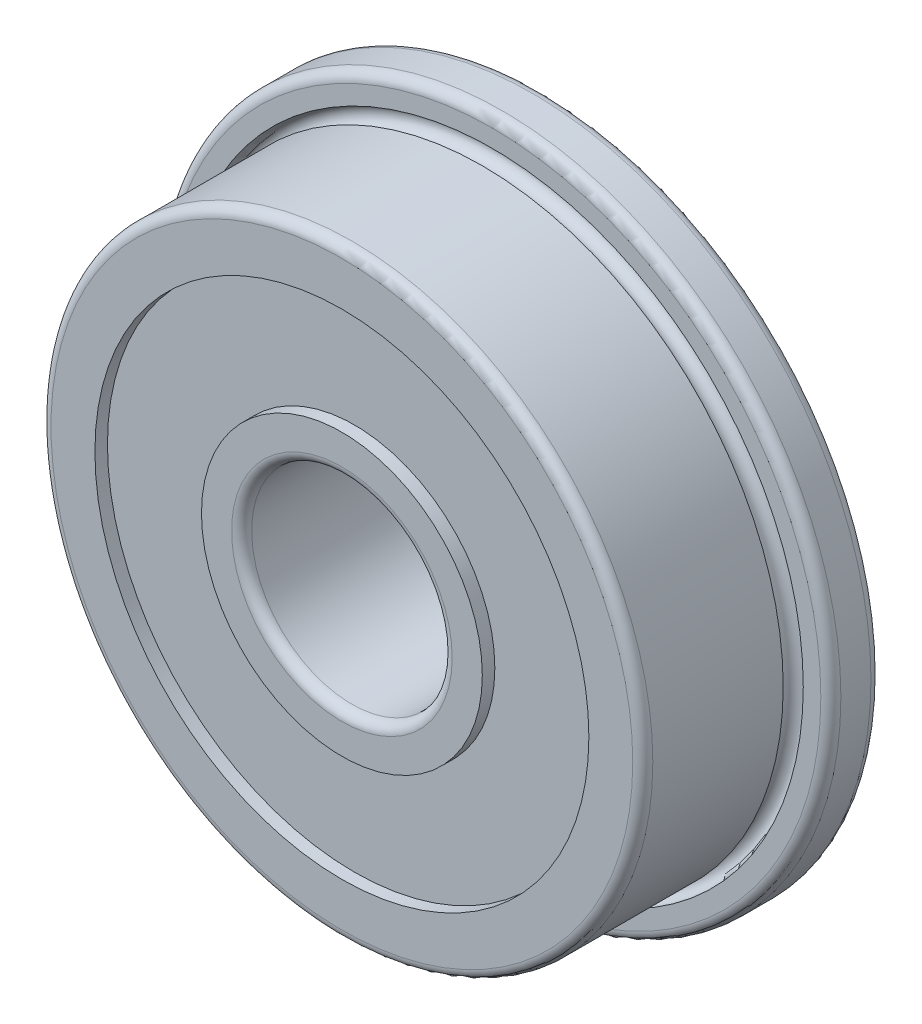
from build123d import *


with BuildPart() as part:
    # Esquisse1 → Révolution1 (revolve)
    with BuildSketch(Plane(origin=(0, 0, 0), x_dir=(0, 0, -1), z_dir=(1, 0, 0)), mode=Mode.PRIVATE) as r_volution1_sk:
        with BuildLine():
            Line((0, 5.8), (0, 4.925))
            Line((0, 4.925), (0.25, 4.925))
            Line((0.25, 4.925), (0.25, 2.8))
            Line((0.25, 2.8), (0, 2.8))
            Line((0, 2.8), (0, 2.2))
            ThreePointArc((0, 2.2), (0.058578644, 2.058578644), (0.2, 2))
            Line((0.2, 2), (3.8, 2))
            ThreePointArc((3.8, 2), (3.941421356, 2.058578644), (4, 2.2))
            Line((4, 2.2), (4, 2.8))
            Line((4, 2.8), (3.75, 2.8))
            Line((3.75, 2.8), (3.75, 4.925))
            Line((3.75, 4.925), (4, 4.925))
            Line((4, 4.925), (4, 6.55))
            ThreePointArc((4, 6.55), (3.941421356, 6.691421356), (3.8, 6.75))
            Line((3.8, 6.75), (3.2, 6.75))
            ThreePointArc((3.2, 6.75), (3.058578644, 6.691421356), (3, 6.55))
            Line((3, 6.55), (3, 6.2))
            ThreePointArc((3, 6.2), (3.141421356, 5.858578644), (2.8, 6))
            Line((2.8, 6), (0.2, 6))
            ThreePointArc((0.2, 6), (0.058578644, 5.941421356), (0, 5.8))
        make_face()
    revolve(r_volution1_sk.sketch.rotate(Axis((0, 0, -4), (0, 0, 1)), 270), axis=Axis((0, 0, -4), (0, 0, 1)))


solid = part.part
